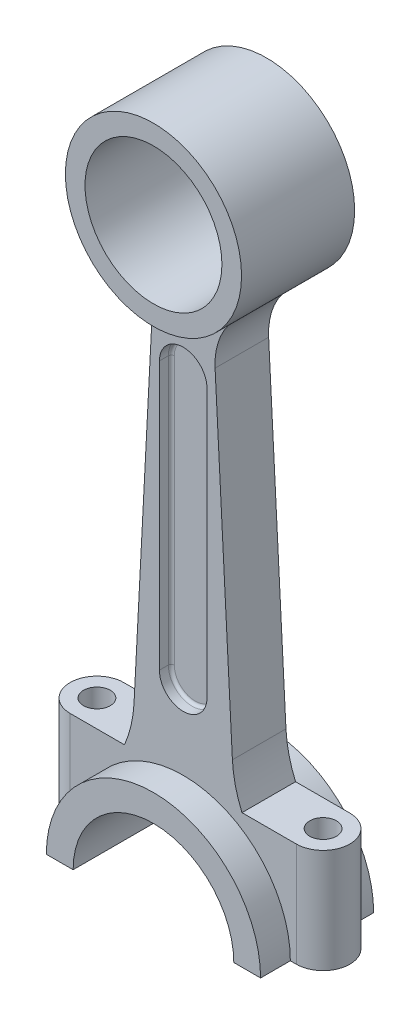
from build123d import *

# Parameters (mm, degrees)
SKETCH1_R             = 29.605080475
SKETCH1_R_2           = 23.004044152
BOSS_EXTRUDE1_DEPTH   = 19
BOSS_EXTRUDE1_2_DEPTH = 19
BOSS_EXTRUDE2_DEPTH   = 9
CUT_EXTRUDE1_DEPTH    = 4
FILLET1_R             = 1
FILLET2_R             = 40
FILLET4_R             = 22.5
BOSS_EXTRUDE3_START   = -35
BOSS_EXTRUDE3_DEPTH   = 35
CUT_EXTRUDE2_DEPTH    = 209.505251732
SKETCH6_R             = 4.5
CUT_EXTRUDE3_DEPTH    = 203.261290265


with BuildPart() as part:
    # Sketch1 → Boss-Extrude1 (new, symmetric)
    with BuildSketch(Plane.XY):
        Circle(SKETCH1_R)
        Circle(SKETCH1_R_2, mode=Mode.SUBTRACT)
    extrude(amount=BOSS_EXTRUDE1_DEPTH, both=True)


with BuildPart() as body_2:
    # Sketch1 → Boss-Extrude1 2 (new, symmetric)
    with BuildSketch(Plane.XY):
        with BuildLine():
            Line((-36, -201.2), (-27, -201.2))
            ThreePointArc((-27, -201.2), (0, -174.2), (27, -201.2))
            Line((27, -201.2), (36, -201.2))
            ThreePointArc((36, -201.2), (0, -165.2), (-36, -201.2))
        make_face()
    extrude(amount=BOSS_EXTRUDE1_2_DEPTH, both=True)

    # Sketch1<3> → Boss-Extrude2 (add, symmetric)
    with BuildSketch(Plane.XY):
        with BuildLine():
            ThreePointArc((10, -27.865046024), (5.075128567, -29.166828075), (0, -29.605080475))
            Line((0, -29.605080475), (0, -165.2))
            ThreePointArc((0, -165.2), (9.002752214, -166.343860619), (17.433399222, -169.702752635))
            Line((17.433399222, -169.702752635), (10, -27.865046024))
        make_face()
        with BuildLine():
            Line((0, -165.2), (0, -29.605080475))
            ThreePointArc((0, -29.605080475), (-5.075128567, -29.166828075), (-10, -27.865046024))
            Line((-10, -27.865046024), (-17.433399222, -169.702752635))
            ThreePointArc((-17.433399222, -169.702752635), (-9.002752214, -166.343860619), (0, -165.2))
        make_face()
    extrude(amount=BOSS_EXTRUDE2_DEPTH, both=True)

    # Sketch2 → Cut-Extrude1 (cut)
    with BuildSketch(Plane(origin=(0, 0, -9), x_dir=(-1, 0, 0), z_dir=(0, 0, -1))):
        with BuildLine():
            Line((-8, -138.611669698), (-8, -48.611669698))
            ThreePointArc((-8, -48.611669698), (0, -40.611669698), (8, -48.611669698))
            Line((8, -48.611669698), (8, -138.611669698))
            ThreePointArc((8, -138.611669698), (0, -146.611669698), (-8, -138.611669698))
        make_face()
    cut_extrude1 = extrude(amount=-CUT_EXTRUDE1_DEPTH, mode=Mode.SUBTRACT)

    # Mirror1: Cut-Extrude1 across plane
    add(cut_extrude1.mirror(Plane.XY), mode=Mode.SUBTRACT)

    # Fillet1
    fillet1_edges = [body_2.edges().sort_by_distance(p)[0] for p in [
        (0, -146.611669698, -5),
        (8, -93.611669698, -5),
        (0, -40.611669698, -5),
        (-8, -93.611669698, -5),
        (0, -146.611669698, 5),
        (-8, -93.611669698, 5),
        (0, -40.611669698, 5),
        (8, -93.611669698, 5),
    ]]
    fillet(fillet1_edges, radius=FILLET1_R)

    # Fillet2
    fillet2_edges = [body_2.edges().sort_by_distance(p)[0] for p in [
        (-17.433399222, -169.702752635, 0),
        (17.433399222, -169.702752635, 0),
    ]]
    fillet(fillet2_edges, radius=FILLET2_R)

    # Combine1: union part
    add(part.part)

    # Fillet4
    fillet4_edges = [body_2.edges().sort_by_distance(p)[0] for p in [
        (10, -27.865046024, 0),
        (-10, -27.865046024, 0),
    ]]
    fillet(fillet4_edges, radius=FILLET4_R)

    # Sketch3 → Boss-Extrude3 (add)
    with BuildSketch(Plane(origin=(0, -166.2, 0), x_dir=(1, 0, 0), z_dir=(0, 1, 0)).offset(BOSS_EXTRUDE3_START)):
        with BuildLine():
            Line((-38, 9), (38, 9))
            ThreePointArc((38, 9), (47, 0), (38, -9))
            Line((38, -9), (-38, -9))
            ThreePointArc((-38, -9), (-47, 0), (-38, 9))
        make_face()
    extrude(amount=BOSS_EXTRUDE3_DEPTH)

    # Sketch5 → Cut-Extrude2 (cut, through all)
    with BuildSketch(Plane.XY.offset(9)):
        with BuildLine():
            Line((-27, -201.2), (27, -201.2))
            ThreePointArc((27, -201.2), (0, -174.2), (-27, -201.2))
        make_face()
    extrude(amount=-CUT_EXTRUDE2_DEPTH, mode=Mode.SUBTRACT)

    # Sketch6 → Cut-Extrude3 (cut, through all)
    with BuildSketch(Plane(origin=(0, -166.2, 0), x_dir=(1, 0, 0), z_dir=(0, 1, 0))):
        with Locations(Location((-38, 0, 0), (0, 0, 270))):
            Circle(SKETCH6_R)
        with Locations(Location((38, 0, 0), (0, 0, 270))):
            Circle(SKETCH6_R)
    extrude(amount=-CUT_EXTRUDE3_DEPTH, mode=Mode.SUBTRACT)


solid = body_2.part
